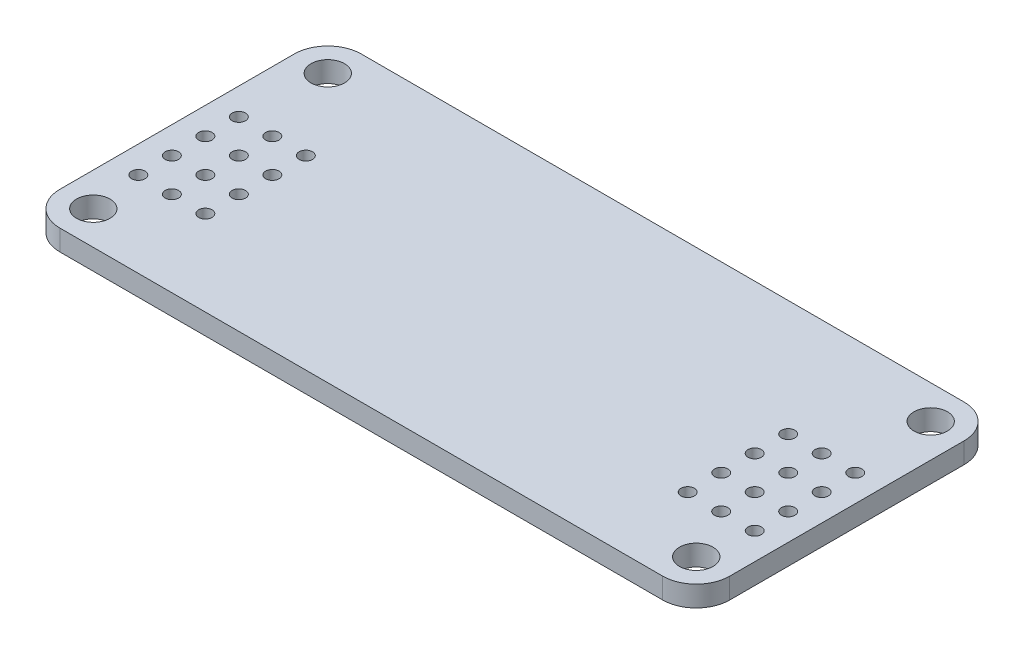
from build123d import *

# Parameters (mm, degrees)
SKETCH1_W                 = 50.8
SKETCH1_H                 = 22.86
BOSS_EXTRUDE1_DEPTH       = 1.57
F_1_16_0_1_DOWEL_HOLE1_D  = 2.54
FILLET1_R                 = 2.54
F_1_16_0_04_DOWEL_HOLE3_D = 1.016
LPATTERN6_COUNT           = 4
LPATTERN6_PITCH           = 2.54
LPATTERN6_COUNT_DIR2      = 2
LPATTERN6_PITCH_DIR2      = 2.54
LPATTERN7_COUNT           = 2
LPATTERN7_PITCH           = 2.54
LPATTERN7_COUNT_DIR2      = 4
LPATTERN7_PITCH_DIR2      = 2.54
LPATTERN8_COUNT           = 2
LPATTERN8_PITCH           = 41.656
LPATTERN8_COPY_1_D        = 1.016
LPATTERN8_COPY_2_D        = 1.016
LPATTERN8_COPY_3_D        = 1.016
LPATTERN8_COPY_4_D        = 1.016
LPATTERN8_COPY_5_D        = 1.016
LPATTERN8_COPY_6_D        = 1.016
LPATTERN8_COPY_7_D        = 1.016
LPATTERN8_COPY_8_D        = 1.016
LPATTERN8_COPY_9_D        = 1.016
LPATTERN8_COPY_10_D       = 1.016
LPATTERN8_COPY_11_D       = 1.016
LPATTERN8_COPY_12_D       = 1.016
LPATTERN8_COPY_13_D       = 1.016
LPATTERN8_COPY_14_D       = 1.016


with BuildPart() as part:
    # Sketch1 → Boss-Extrude1 (new body)
    with BuildSketch(Plane(origin=(0, 0, 0), x_dir=(1, 0, 0), z_dir=(0, 1, 0))):
        Rectangle(SKETCH1_W, SKETCH1_H)
    extrude(amount=BOSS_EXTRUDE1_DEPTH)

    # 1/16 (0.1) Dowel Hole1 (through all)
    with Locations(Plane(origin=(0, 1.57, 0), x_dir=(1, 0, 0), z_dir=(0, 1, 0))):
        with Locations((-22.86, 8.89), (22.86, 8.89), (22.86, -8.89), (-22.86, -8.89)):
            Hole(F_1_16_0_1_DOWEL_HOLE1_D / 2)

    # Fillet1
    fillet1_edges = [part.edges().sort_by_distance(p)[0] for p in [
        (25.4, 0.785, 11.43),
        (-25.4, 0.785, 11.43),
        (-25.4, 0.785, -11.43),
        (25.4, 0.785, -11.43),
    ]]
    fillet(fillet1_edges, radius=FILLET1_R)

    # 1/16 (0.04) Dowel Hole3 (through all)
    with Locations(Plane(origin=(0, 1.57, 0), x_dir=(1, 0, 0), z_dir=(0, 1, 0))):
        with Locations((-20.828, -4.965370827)):
            f_1_16_0_04_dowel_hole3 = Hole(F_1_16_0_04_DOWEL_HOLE3_D / 2)

    # LPattern6: 1_16 _0.04_ Dowel Hole3 4 × 2
    with Locations(*[(-j * LPATTERN6_PITCH_DIR2, 0, -i * LPATTERN6_PITCH) for i in range(LPATTERN6_COUNT) for j in range(LPATTERN6_COUNT_DIR2) if (i, j) != (0, 0)]):
        add(f_1_16_0_04_dowel_hole3, mode=Mode.SUBTRACT)

    # LPattern7: 1_16 _0.04_ Dowel Hole3 2 × 4
    with Locations(*[(i * LPATTERN7_PITCH, 0, -j * LPATTERN7_PITCH_DIR2) for i in range(LPATTERN7_COUNT) for j in range(LPATTERN7_COUNT_DIR2) if (i, j) != (0, 0)]):
        add(f_1_16_0_04_dowel_hole3, mode=Mode.SUBTRACT)

    # LPattern8: 1/16 (0.04) Dowel Hole3 ×2
    with Locations(*[(i * LPATTERN8_PITCH, 0, 0) for i in range(1, LPATTERN8_COUNT)]):
        add(f_1_16_0_04_dowel_hole3, mode=Mode.SUBTRACT)

    # LPattern8 copy 1 (through all)
    with Locations(Plane(origin=(39.116, 1.57, 0), x_dir=(1, 0, 0), z_dir=(0, 1, 0))):
        with Locations((-20.828, -4.965370827)):
            Hole(LPATTERN8_COPY_1_D / 2)

    # LPattern8 copy 2 (through all)
    with Locations(Plane(origin=(41.656, 1.57, -2.54), x_dir=(1, 0, 0), z_dir=(0, 1, 0))):
        with Locations((-20.828, -4.965370827)):
            Hole(LPATTERN8_COPY_2_D / 2)

    # LPattern8 copy 3 (through all)
    with Locations(Plane(origin=(39.116, 1.57, -2.54), x_dir=(1, 0, 0), z_dir=(0, 1, 0))):
        with Locations((-20.828, -4.965370827)):
            Hole(LPATTERN8_COPY_3_D / 2)

    # LPattern8 copy 4 (through all)
    with Locations(Plane(origin=(41.656, 1.57, -5.08), x_dir=(1, 0, 0), z_dir=(0, 1, 0))):
        with Locations((-20.828, -4.965370827)):
            Hole(LPATTERN8_COPY_4_D / 2)

    # LPattern8 copy 5 (through all)
    with Locations(Plane(origin=(39.116, 1.57, -5.08), x_dir=(1, 0, 0), z_dir=(0, 1, 0))):
        with Locations((-20.828, -4.965370827)):
            Hole(LPATTERN8_COPY_5_D / 2)

    # LPattern8 copy 6 (through all)
    with Locations(Plane(origin=(41.656, 1.57, -7.62), x_dir=(1, 0, 0), z_dir=(0, 1, 0))):
        with Locations((-20.828, -4.965370827)):
            Hole(LPATTERN8_COPY_6_D / 2)

    # LPattern8 copy 7 (through all)
    with Locations(Plane(origin=(39.116, 1.57, -7.62), x_dir=(1, 0, 0), z_dir=(0, 1, 0))):
        with Locations((-20.828, -4.965370827)):
            Hole(LPATTERN8_COPY_7_D / 2)

    # LPattern8 copy 8 (through all)
    with Locations(Plane(origin=(41.656, 1.57, -2.54), x_dir=(1, 0, 0), z_dir=(0, 1, 0))):
        with Locations((-20.828, -4.965370827)):
            Hole(LPATTERN8_COPY_8_D / 2)

    # LPattern8 copy 9 (through all)
    with Locations(Plane(origin=(41.656, 1.57, -5.08), x_dir=(1, 0, 0), z_dir=(0, 1, 0))):
        with Locations((-20.828, -4.965370827)):
            Hole(LPATTERN8_COPY_9_D / 2)

    # LPattern8 copy 10 (through all)
    with Locations(Plane(origin=(41.656, 1.57, -7.62), x_dir=(1, 0, 0), z_dir=(0, 1, 0))):
        with Locations((-20.828, -4.965370827)):
            Hole(LPATTERN8_COPY_10_D / 2)

    # LPattern8 copy 11 (through all)
    with Locations(Plane(origin=(44.196, 1.57, 0), x_dir=(1, 0, 0), z_dir=(0, 1, 0))):
        with Locations((-20.828, -4.965370827)):
            Hole(LPATTERN8_COPY_11_D / 2)

    # LPattern8 copy 12 (through all)
    with Locations(Plane(origin=(44.196, 1.57, -2.54), x_dir=(1, 0, 0), z_dir=(0, 1, 0))):
        with Locations((-20.828, -4.965370827)):
            Hole(LPATTERN8_COPY_12_D / 2)

    # LPattern8 copy 13 (through all)
    with Locations(Plane(origin=(44.196, 1.57, -5.08), x_dir=(1, 0, 0), z_dir=(0, 1, 0))):
        with Locations((-20.828, -4.965370827)):
            Hole(LPATTERN8_COPY_13_D / 2)

    # LPattern8 copy 14 (through all)
    with Locations(Plane(origin=(44.196, 1.57, -7.62), x_dir=(1, 0, 0), z_dir=(0, 1, 0))):
        with Locations((-20.828, -4.965370827)):
            Hole(LPATTERN8_COPY_14_D / 2)


solid = part.part
